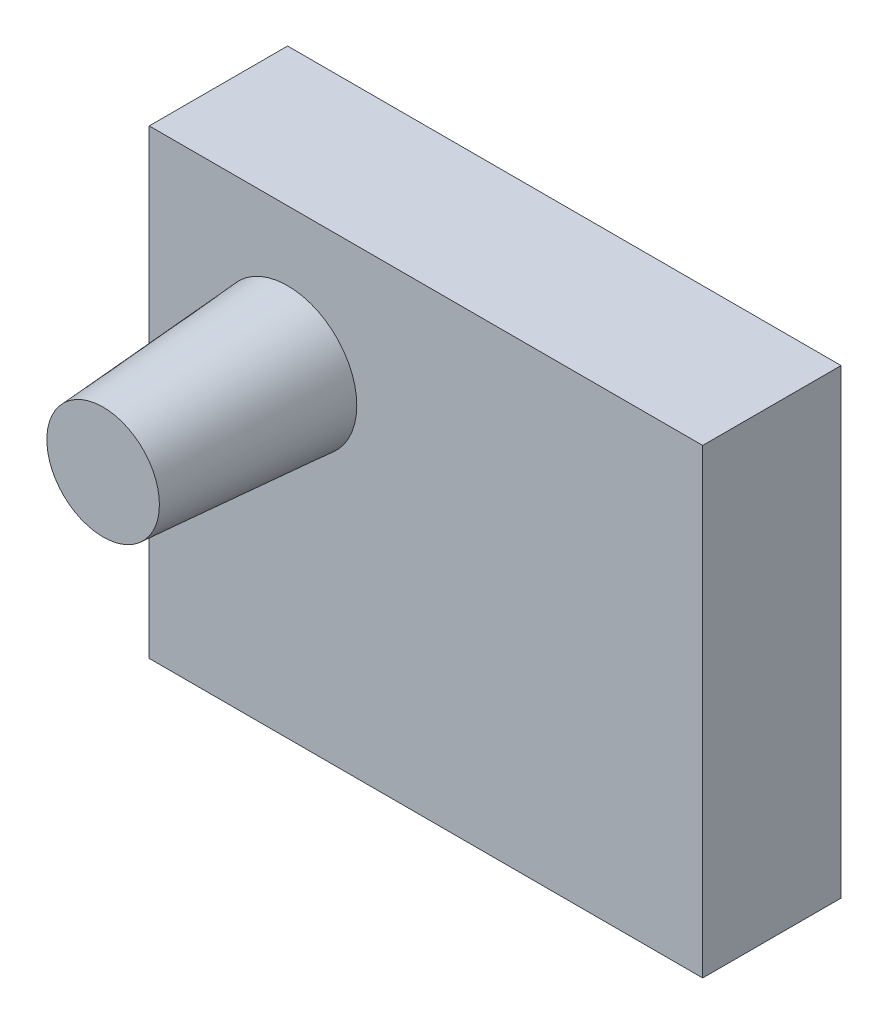
from build123d import *

# Parameters (mm, degrees)
CROQUIS1_W              = 120
CROQUIS1_H              = 100
SALIENTE_EXTRUIR1_DEPTH = 30
CROQUIS3_R              = 15
SALIENTE_EXTRUIR3_DEPTH = 40
SALIENTE_EXTRUIR3_TAPER = 4


with BuildPart() as part:
    # Croquis1 → Saliente-Extruir1 (new body)
    with BuildSketch(Plane.XY):
        with Locations((60, 50)):
            Rectangle(CROQUIS1_W, CROQUIS1_H)
    extrude(amount=SALIENTE_EXTRUIR1_DEPTH)

    # Croquis3 → Saliente-Extruir3 (add)
    with BuildSketch(Plane.XY.offset(30)):
        with Locations((30, 70)):
            Circle(CROQUIS3_R)
    extrude(amount=SALIENTE_EXTRUIR3_DEPTH, taper=SALIENTE_EXTRUIR3_TAPER)


solid = part.part
